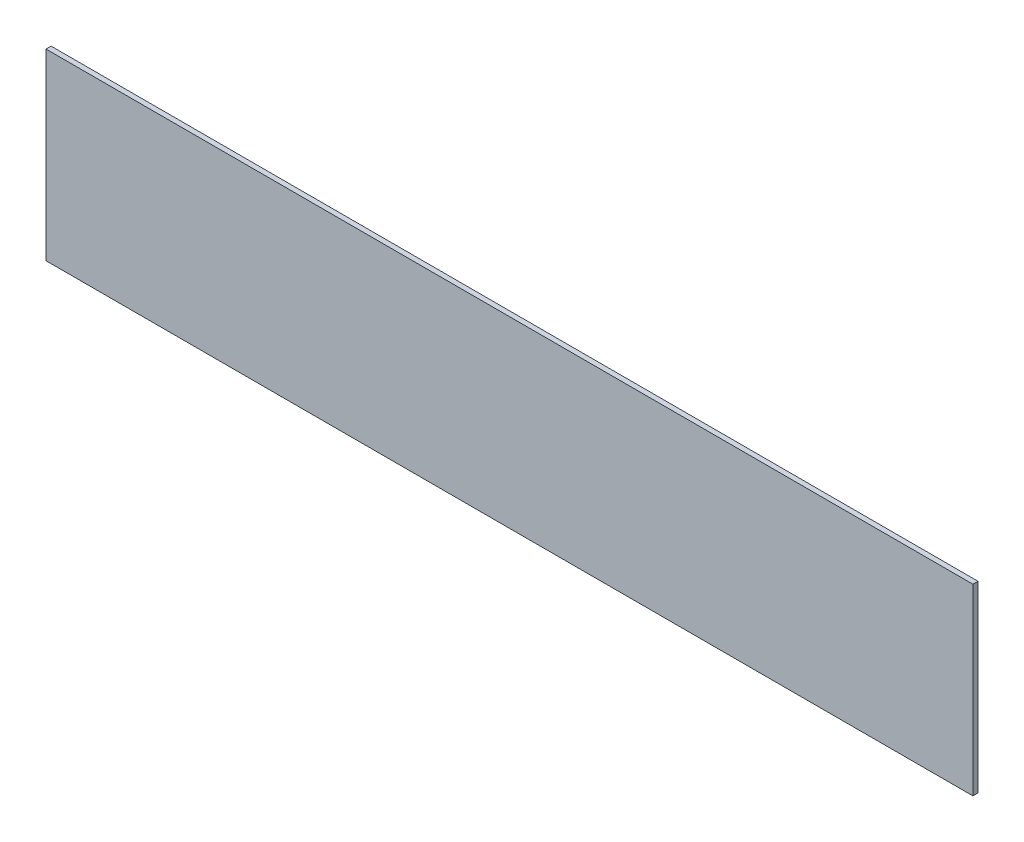
from build123d import *

# Parameters (mm, degrees)
TOPPING_KLAPE_KAT3_KULP_CUKURU_1_START = 26
SKETCH1_W                              = 182
SKETCH1_H                              = 36
TOPPING_KLAPE_KAT3_KULP_CUKURU_1_DEPTH = 1


with BuildPart() as part:
    # Sketch1 → TOPPING_klape_kat3_kulp_cukuru_1 (new body)
    with BuildSketch(Plane.XY.offset(TOPPING_KLAPE_KAT3_KULP_CUKURU_1_START)):
        with Locations((350, 945)):
            Rectangle(SKETCH1_W, SKETCH1_H)
    extrude(amount=TOPPING_KLAPE_KAT3_KULP_CUKURU_1_DEPTH)


solid = part.part
